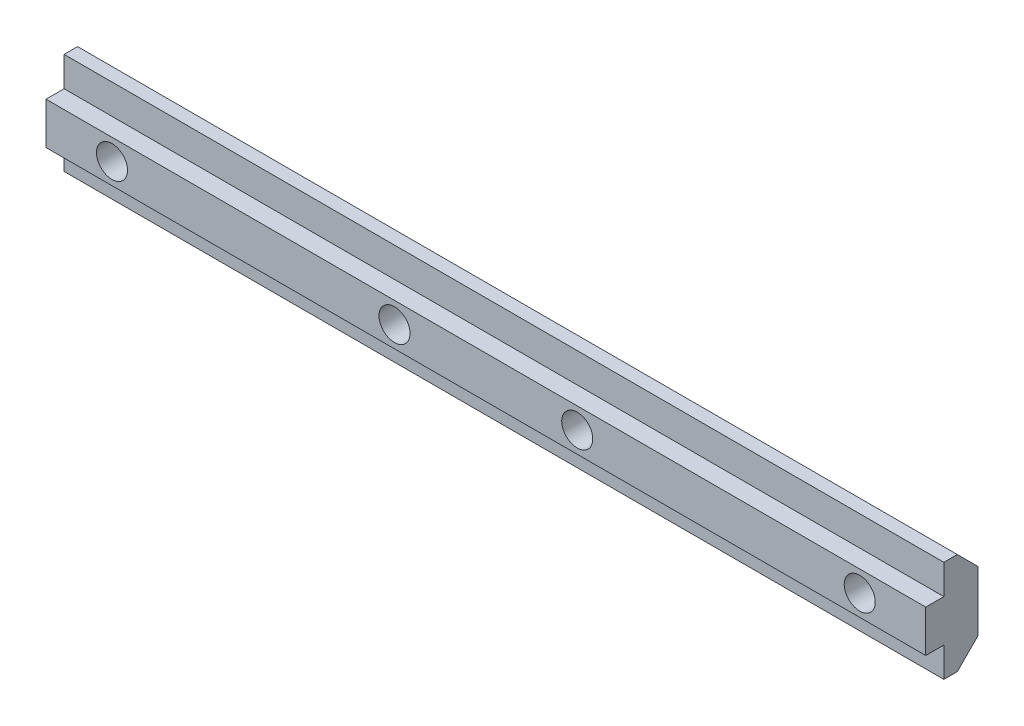
from build123d import *

# Parameters (mm, degrees)
SKETCH_1_W          = 170
SKETCH_1_H          = 19.6
EXTRUDE_1_DEPTH     = 6.6
SKETCH_2_W          = 170
SKETCH_2_H          = 8.1
EXTRUDE_2_DEPTH     = 3.5
SKETCH_3_R          = 3
CUT_EXTRUDE_1_DEPTH = 87.157123907
CHAMFER_1_SIZE      = 4


with BuildPart() as part:
    # 草图1 → 凸台-拉伸1 (new body)
    with BuildSketch(Plane.XY):
        Rectangle(SKETCH_1_W, SKETCH_1_H)
    extrude(amount=EXTRUDE_1_DEPTH)

    # 草图2 → 凸台-拉伸2 (add)
    with BuildSketch(Plane.XY.offset(6.6)):
        Rectangle(SKETCH_2_W, SKETCH_2_H)
    extrude(amount=EXTRUDE_2_DEPTH)

    # 草图3 → 切除-拉伸1 (cut, through all)
    with BuildSketch(Plane.XY.offset(10.1)):
        with Locations((-72.247114829, 0)):
            Circle(SKETCH_3_R)
        with Locations((-17.653434016, 0)):
            Circle(SKETCH_3_R)
        with Locations(Location((17.653434016, 0, 0), (0, 0, 180))):
            Circle(SKETCH_3_R)
        with Locations(Location((72.247114829, 0, 0), (0, 0, 180))):
            Circle(SKETCH_3_R)
    extrude(amount=-CUT_EXTRUDE_1_DEPTH, mode=Mode.SUBTRACT)

    # 倒角1
    chamfer_1_edges = [part.edges().sort_by_distance(p)[0] for p in [
        (0, -9.8, 0),
        (0, 9.8, 0),
    ]]
    chamfer(chamfer_1_edges, length=CHAMFER_1_SIZE)


solid = part.part
